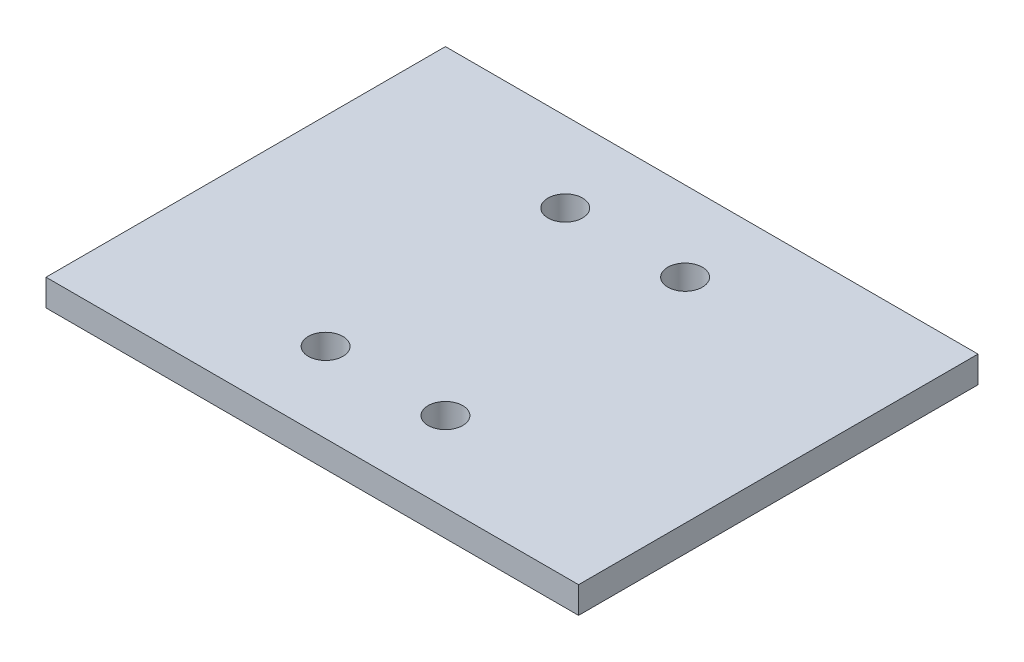
from build123d import *

# Parameters (mm, degrees)
SKETCH1_W           = 40
SKETCH1_H           = 30
SKETCH1_R           = 1.3
BOSS_EXTRUDE1_DEPTH = 2


with BuildPart() as part:
    # Sketch1 → Boss-Extrude1 (new body)
    with BuildSketch(Plane(origin=(0, 0, 0), x_dir=(1, 0, 0), z_dir=(0, 1, 0))):
        with Locations((5, -9)):
            Rectangle(SKETCH1_W, SKETCH1_H)
        with Locations(Location((0, 0, 0), (0, 0, 270))):
            Circle(SKETCH1_R, mode=Mode.SUBTRACT)
        with Locations(Location((9, 0, 0), (0, 0, 270))):
            Circle(SKETCH1_R, mode=Mode.SUBTRACT)
        with Locations(Location((0, -18, 0), (0, 0, 270))):
            Circle(SKETCH1_R, mode=Mode.SUBTRACT)
        with Locations(Location((9, -18, 0), (0, 0, 270))):
            Circle(SKETCH1_R, mode=Mode.SUBTRACT)
    extrude(amount=BOSS_EXTRUDE1_DEPTH)


solid = part.part
